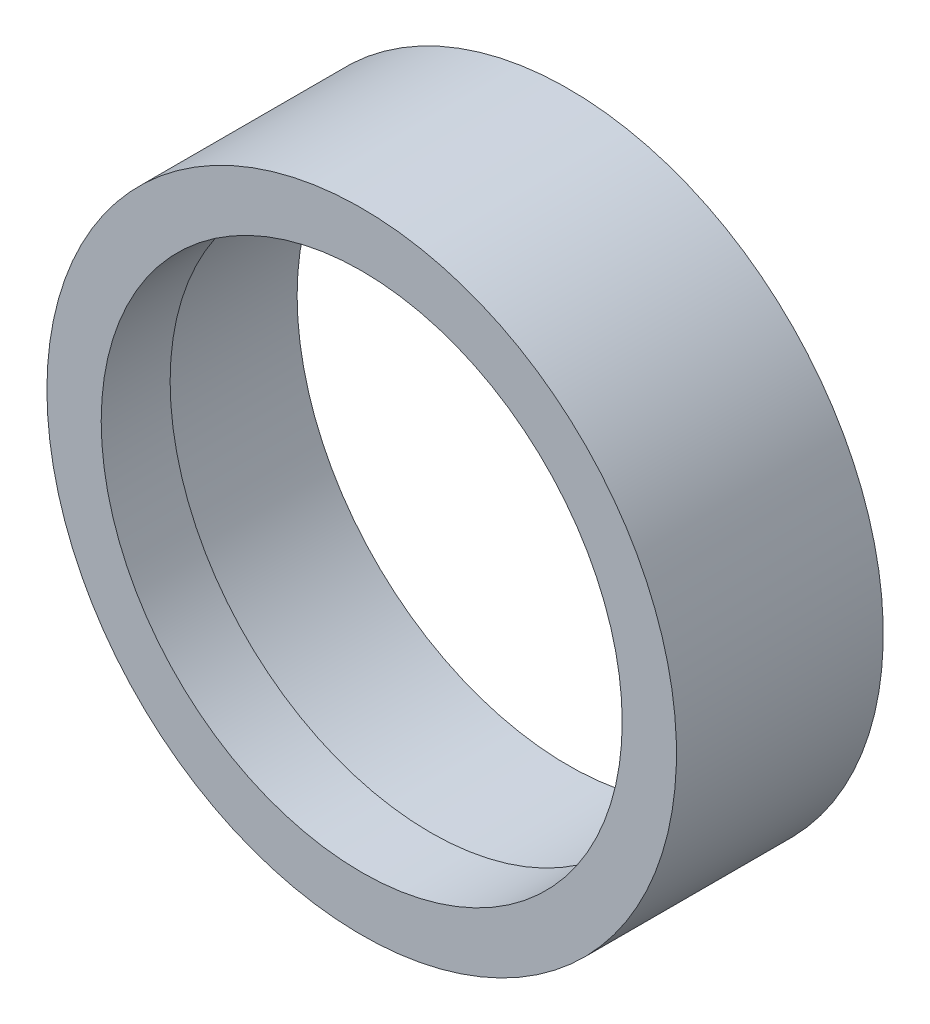
from build123d import *

# Parameters (mm, degrees)
SKETCH1_R           = 29
SKETCH1_R_2         = 25
BOSS_EXTRUDE1_DEPTH = 19.05
BOSS_EXTRUDE2_START = -6.35
SKETCH2_R           = 25
SKETCH2_R_2         = 24
BOSS_EXTRUDE2_DEPTH = 6.35


with BuildPart() as part:
    # Sketch1 → Boss-Extrude1 (new body)
    with BuildSketch(Plane.XY):
        Circle(SKETCH1_R)
        Circle(SKETCH1_R_2, mode=Mode.SUBTRACT)
    extrude(amount=BOSS_EXTRUDE1_DEPTH)

    # Sketch2 → Boss-Extrude2 (add)
    with BuildSketch(Plane.XY.offset(19.05).offset(BOSS_EXTRUDE2_START)):
        Circle(SKETCH2_R)
        Circle(SKETCH2_R_2, mode=Mode.SUBTRACT)
    extrude(amount=BOSS_EXTRUDE2_DEPTH)


solid = part.part
